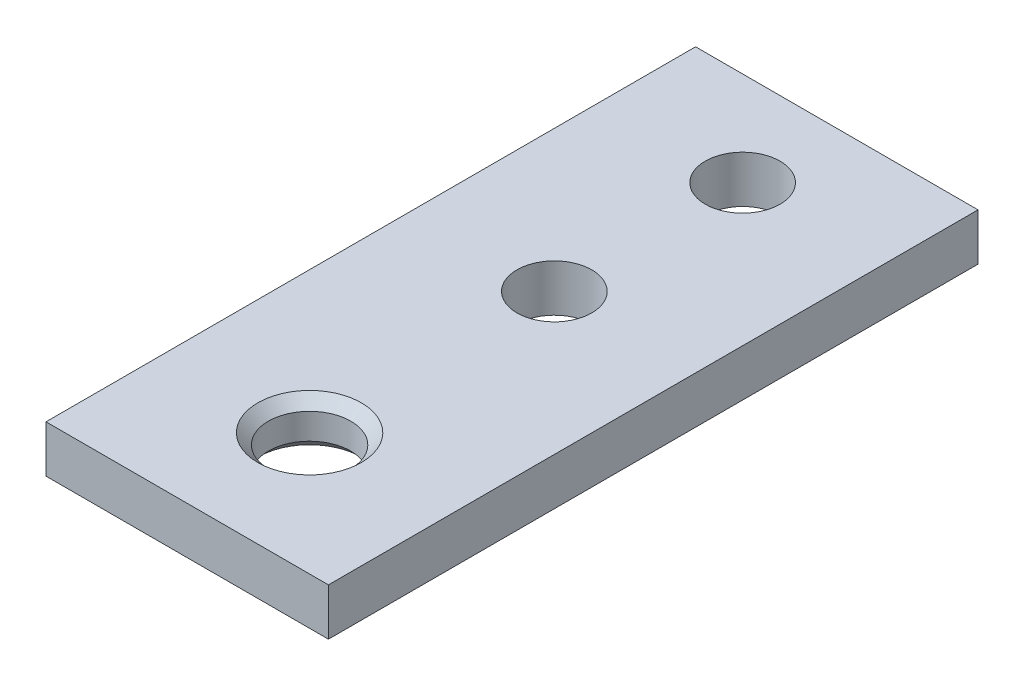
from build123d import *

# Parameters (mm, degrees)
SKETCH1_W                   = 38.1
SKETCH1_H                   = 6.35
EXTRUDE1_DEPTH              = 87.63
F_3_8_CLEARANCE_HOLE1_D     = 10.0838
F_3_8_CLEARANCE_HOLE1_DEPTH = 16.002
F_3_8_CLEARANCE_HOLE1_TIP   = 3.029479155


with BuildPart() as part:
    # Sketch1 → Extrude1 (new body)
    with BuildSketch(Plane.XY):
        Rectangle(SKETCH1_W, SKETCH1_H)
    extrude(amount=EXTRUDE1_DEPTH)

    # 3/8 Clearance Hole1
    with Locations(Plane(origin=(0, 3.175, 12.7), x_dir=(0, 0, 1), z_dir=(0, 1, 0))):
        with Locations((0, 0), (25.4, 0)):
            Hole(F_3_8_CLEARANCE_HOLE1_D / 2, depth=F_3_8_CLEARANCE_HOLE1_DEPTH)
            with Locations((0, 0, -(F_3_8_CLEARANCE_HOLE1_DEPTH + F_3_8_CLEARANCE_HOLE1_TIP / 2))):  # 118° drill point
                Cone(0, F_3_8_CLEARANCE_HOLE1_D / 2, F_3_8_CLEARANCE_HOLE1_TIP, mode=Mode.SUBTRACT)

    # Sketch4 → 7/16 (0.4375) Diameter Hole2 (revolve, cut)
    with BuildSketch(Plane(origin=(0, 3.175, 71.12), x_dir=(0, 0, 1), z_dir=(1, 0, 0))):
        Polygon((0, 0), (0, 6.35), (6.985, 6.35), (5.55625, 4.92125), (5.55625, 1.42875), (6.985, 0), align=None)
    revolve(axis=Axis((0, 9.525, 71.12), (0, -1, 0)), mode=Mode.SUBTRACT)


solid = part.part
